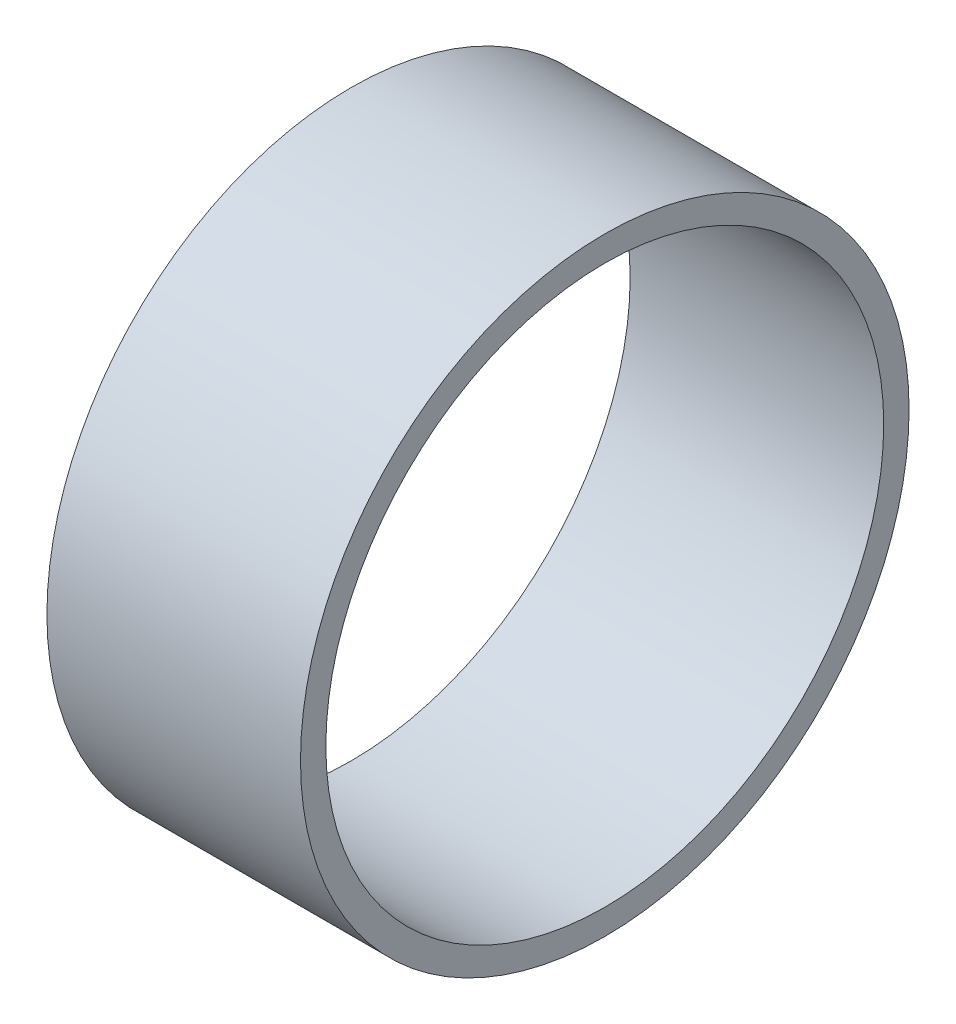
from build123d import *

# Parameters (mm, degrees)
SKETCH1_W = 127
SKETCH1_H = 12.7


with BuildPart() as part:
    # Sketch1 → Revolve1 (revolve)
    with BuildSketch(Plane.XY, mode=Mode.PRIVATE) as revolve1_sk:
        with Locations((0, 146.05)):
            Rectangle(SKETCH1_W, SKETCH1_H)
    revolve(revolve1_sk.sketch.rotate(Axis((0, 0, 0), (1, 0, 0)), 90), axis=Axis((0, 0, 0), (1, 0, 0)))


solid = part.part
